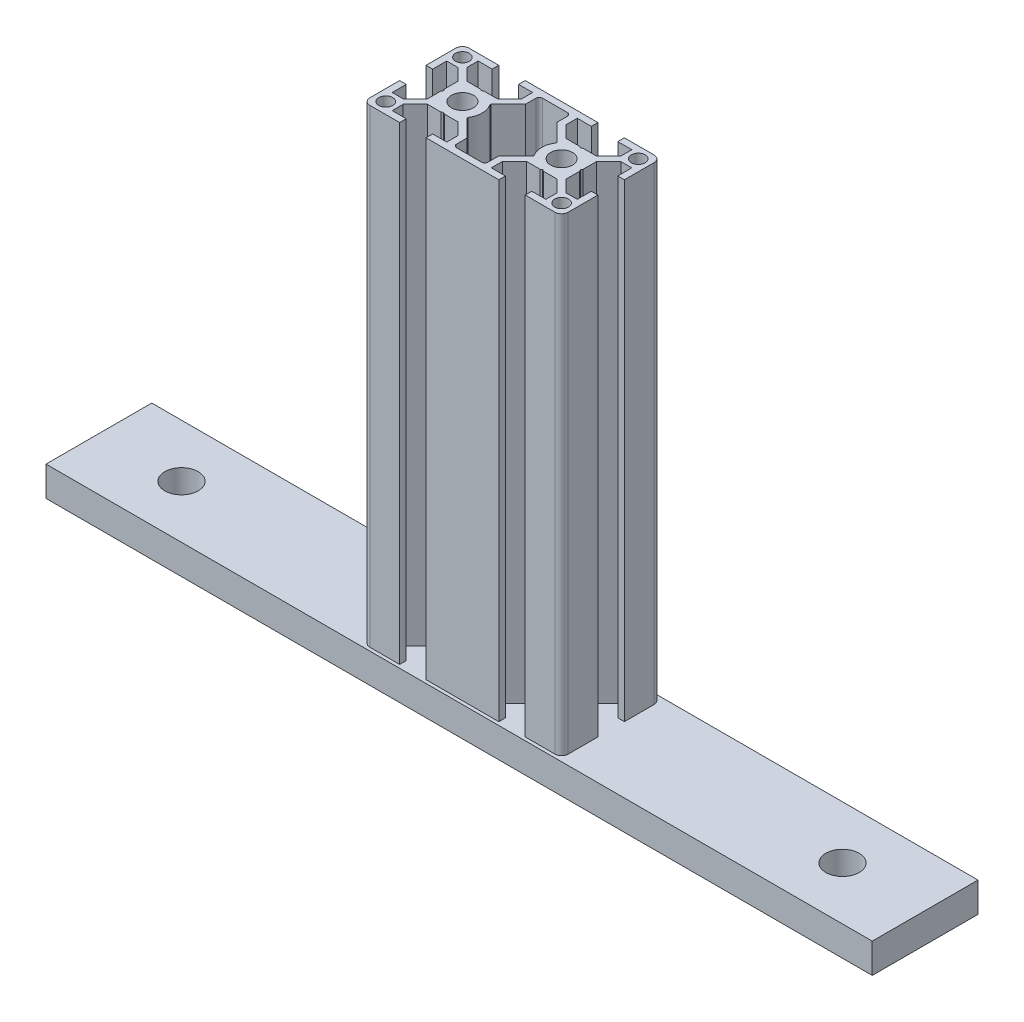
from build123d import *

# Parameters (mm, degrees)
SKETCH1_W                = 32
SKETCH1_H                = 9
BOSS_EXTRUDE1_DEPTH      = 125
TAP1_D                   = 10.106
SKETCH4_R                = 4.5
CUT_EXTRUDE1_DEPTH       = 127.340808926
SKETCH5_R                = 2.1
SKETCH5_R_2              = 3.3235
BOSS_EXTRUDE2_DEPTH      = 142
CUT_EXTRUDE2_DEPTH       = 4
CHAMFER1_SIZE            = 0.3
CHAMFER1_OF_MIRROR1_SIZE = 0.3


with BuildPart() as part:
    # Sketch1 → Boss-Extrude1 (new, symmetric)
    with BuildSketch(Plane(origin=(0, 0, 0), x_dir=(0, 0, -1), z_dir=(1, 0, 0))):
        with Locations((0, 74.5)):
            Rectangle(SKETCH1_W, SKETCH1_H)
    extrude(amount=BOSS_EXTRUDE1_DEPTH, both=True)

    # Tap1 (through all)
    with Locations(Plane(origin=(0, 79, 0), x_dir=(1, 0, 0), z_dir=(0, 1, 0))):
        with Locations((-100, 0), (100, 0)):
            Hole(TAP1_D / 2)

    # Sketch4 → Cut-Extrude1 (cut, through all)
    with BuildSketch(Plane(origin=(0, 79, 0), x_dir=(1, 0, 0), z_dir=(0, 1, 0))):
        with Locations(Location((-15, 0, 0), (0, 0, 270))):
            Circle(SKETCH4_R)
        with Locations(Location((15, 0, 0), (0, 0, 270))):
            Circle(SKETCH4_R)
    extrude(amount=-CUT_EXTRUDE1_DEPTH, mode=Mode.SUBTRACT)

    # Sketch5 → Boss-Extrude2 (add)
    with BuildSketch(Plane(origin=(0, 79, 0), x_dir=(1, 0, 0), z_dir=(0, 1, 0))):
        with BuildLine():
            Line((-11, -15), (11, -15))
            Line((11, -15), (11, -13))
            Line((11, -13), (6.75, -13))
            Line((6.75, -13), (6.75, -9.664213562))
            Line((6.75, -9.664213562), (10.414213562, -6))
            Line((10.414213562, -6), (14.480384758, -6))
            Line((14.480384758, -6), (15, -5.7))
            Line((15, -5.7), (15.519615242, -6))
            Line((15.519615242, -6), (19.585786438, -6))
            Line((19.585786438, -6), (23.25, -9.664213562))
            Line((23.25, -9.664213562), (23.25, -13))
            Line((23.25, -13), (19, -13))
            Line((19, -13), (19, -15))
            Line((19, -15), (28, -15))
            ThreePointArc((28, -15), (29.414213562, -14.414213562), (30, -13))
            Line((30, -13), (30, -4))
            Line((30, -4), (28, -4))
            Line((28, -4), (28, -8.25))
            Line((28, -8.25), (24.664213562, -8.25))
            Line((24.664213562, -8.25), (21, -4.585786438))
            Line((21, -4.585786438), (21, -0.519615242))
            Line((21, -0.519615242), (20.7, 0))
            Line((20.7, 0), (21, 0.519615242))
            Line((21, 0.519615242), (21, 4.585786438))
            Line((21, 4.585786438), (24.664213562, 8.25))
            Line((24.664213562, 8.25), (28, 8.25))
            Line((28, 8.25), (28, 4))
            Line((28, 4), (30, 4))
            Line((30, 4), (30, 13))
            ThreePointArc((30, 13), (29.414213562, 14.414213562), (28, 15))
            Line((28, 15), (19, 15))
            Line((19, 15), (19, 13))
            Line((19, 13), (23.25, 13))
            Line((23.25, 13), (23.25, 9.664213562))
            Line((23.25, 9.664213562), (19.585786438, 6))
            Line((19.585786438, 6), (15.519615242, 6))
            Line((15.519615242, 6), (15, 5.7))
            Line((15, 5.7), (14.480384758, 6))
            Line((14.480384758, 6), (10.414213562, 6))
            Line((10.414213562, 6), (6.75, 9.664213562))
            Line((6.75, 9.664213562), (6.75, 13))
            Line((6.75, 13), (11, 13))
            Line((11, 13), (11, 15))
            Line((11, 15), (-11, 15))
            Line((-11, 15), (-11, 13))
            Line((-11, 13), (-6.75, 13))
            Line((-6.75, 13), (-6.75, 9.664213562))
            Line((-6.75, 9.664213562), (-10.414213562, 6))
            Line((-10.414213562, 6), (-14.480384758, 6))
            Line((-14.480384758, 6), (-15, 5.7))
            Line((-15, 5.7), (-15.519615242, 6))
            Line((-15.519615242, 6), (-19.585786438, 6))
            Line((-19.585786438, 6), (-23.25, 9.664213562))
            Line((-23.25, 9.664213562), (-23.25, 13))
            Line((-23.25, 13), (-19, 13))
            Line((-19, 13), (-19, 15))
            Line((-19, 15), (-28, 15))
            ThreePointArc((-28, 15), (-29.414213562, 14.414213562), (-30, 13))
            Line((-30, 13), (-30, 4))
            Line((-30, 4), (-28, 4))
            Line((-28, 4), (-28, 8.25))
            Line((-28, 8.25), (-24.664213562, 8.25))
            Line((-24.664213562, 8.25), (-21, 4.585786438))
            Line((-21, 4.585786438), (-21, 0.519615242))
            Line((-21, 0.519615242), (-20.7, 0))
            Line((-20.7, 0), (-21, -0.519615242))
            Line((-21, -0.519615242), (-21, -4.585786438))
            Line((-21, -4.585786438), (-24.664213562, -8.25))
            Line((-24.664213562, -8.25), (-28, -8.25))
            Line((-28, -8.25), (-28, -4))
            Line((-28, -4), (-30, -4))
            Line((-30, -4), (-30, -13))
            ThreePointArc((-30, -13), (-29.414213562, -14.414213562), (-28, -15))
            Line((-28, -15), (-19, -15))
            Line((-19, -15), (-19, -13))
            Line((-19, -13), (-23.25, -13))
            Line((-23.25, -13), (-23.25, -9.664213562))
            Line((-23.25, -9.664213562), (-19.585786438, -6))
            Line((-19.585786438, -6), (-15.519615242, -6))
            Line((-15.519615242, -6), (-15, -5.7))
            Line((-15, -5.7), (-14.480384758, -6))
            Line((-14.480384758, -6), (-10.414213562, -6))
            Line((-10.414213562, -6), (-6.75, -9.664213562))
            Line((-6.75, -9.664213562), (-6.75, -13))
            Line((-6.75, -13), (-11, -13))
            Line((-11, -13), (-11, -15))
        make_face()
        with Locations(Location((-26.6, -11.6, 0), (0, 0, 270))):
            Circle(SKETCH5_R, mode=Mode.SUBTRACT)
        with Locations(Location((-26.6, 11.6, 0), (0, 0, 270))):
            Circle(SKETCH5_R, mode=Mode.SUBTRACT)
        with Locations(Location((-15, 0, 0), (0, 0, 270))):
            Circle(SKETCH5_R_2, mode=Mode.SUBTRACT)
        with Locations(Location((26.6, -11.6, 0), (0, 0, 270))):
            Circle(SKETCH5_R, mode=Mode.SUBTRACT)
        with Locations(Location((15, 0, 0), (0, 0, 270))):
            Circle(SKETCH5_R_2, mode=Mode.SUBTRACT)
        with Locations(Location((26.6, 11.6, 0), (0, 0, 270))):
            Circle(SKETCH5_R, mode=Mode.SUBTRACT)
        with BuildLine():
            Line((4.75, 8.835786438), (4.75, 12))
            ThreePointArc((4.75, 12), (4.457106781, 12.707106781), (3.75, 13))
            Line((3.75, 13), (-3.75, 13))
            ThreePointArc((-3.75, 13), (-4.457106781, 12.707106781), (-4.75, 12))
            Line((-4.75, 12), (-4.75, 8.835786438))
            Line((-4.75, 8.835786438), (-9.933994275, 3.651792162))
            ThreePointArc((-9.933994275, 3.651792162), (-10.020243756, 3.470780401), (-9.973202134, 3.275866789))
            ThreePointArc((-9.973202134, 3.275866789), (-9, 0), (-9.973202134, -3.275866789))
            ThreePointArc((-9.973202134, -3.275866789), (-10.020243756, -3.470780401), (-9.933994275, -3.651792162))
            Line((-9.933994275, -3.651792162), (-4.75, -8.835786438))
            Line((-4.75, -8.835786438), (-4.75, -12))
            ThreePointArc((-4.75, -12), (-4.457106781, -12.707106781), (-3.75, -13))
            Line((-3.75, -13), (3.75, -13))
            ThreePointArc((3.75, -13), (4.457106781, -12.707106781), (4.75, -12))
            Line((4.75, -12), (4.75, -8.835786438))
            Line((4.75, -8.835786438), (9.933994275, -3.651792162))
            ThreePointArc((9.933994275, -3.651792162), (10.020243756, -3.470780401), (9.973202134, -3.275866789))
            ThreePointArc((9.973202134, -3.275866789), (9, 0), (9.973202134, 3.275866789))
            ThreePointArc((9.973202134, 3.275866789), (10.020243756, 3.470780401), (9.933994275, 3.651792162))
            Line((9.933994275, 3.651792162), (4.75, 8.835786438))
        make_face(mode=Mode.SUBTRACT)
    extrude(amount=BOSS_EXTRUDE2_DEPTH)

    # Sketch6 → Revolve1 (revolve)
    with BuildSketch(Plane.XY, mode=Mode.PRIVATE) as revolve1_sk:
        Polygon((18, 62), (21.5, 62), (21.5, 70), (19, 70), (19, 95), (15, 95), (15, 67.732050808), (18, 66), align=None)
    revolve1 = revolve(revolve1_sk.sketch.rotate(Axis((15, 95, 0), (0, -1, 0)), 180), axis=Axis((15, 95, 0), (0, -1, 0)))

    # Sketch7 → Cut-Extrude2 (cut)
    with BuildSketch(Plane.XZ.offset(-62)):
        Polygon((18.464101615, 0), (16.732050808, 3), (13.267949192, 3), (11.535898385, 0), (13.267949192, -3), (16.732050808, -3), align=None)
    cut_extrude2 = extrude(amount=-CUT_EXTRUDE2_DEPTH, mode=Mode.SUBTRACT)

    # Chamfer1
    chamfer1_edges = [part.edges().sort_by_distance(p)[0] for p in [
        (21.5, 62, 0),
    ]]
    chamfer(chamfer1_edges, length=CHAMFER1_SIZE)

    # Mirror1: Revolve1, Cut-Extrude2 across plane
    add(revolve1.mirror(Plane(origin=(0, 0, 0), x_dir=(0, 0, 1), z_dir=(1, 0, 0))))
    add(cut_extrude2.mirror(Plane(origin=(0, 0, 0), x_dir=(0, 0, 1), z_dir=(1, 0, 0))), mode=Mode.SUBTRACT)

    # Chamfer1 of Mirror1
    chamfer1_of_mirror1_edges = [part.edges().sort_by_distance(p)[0] for p in [
        (-21.5, 62, 0),
    ]]
    chamfer(chamfer1_of_mirror1_edges, length=CHAMFER1_OF_MIRROR1_SIZE)


solid = part.part
